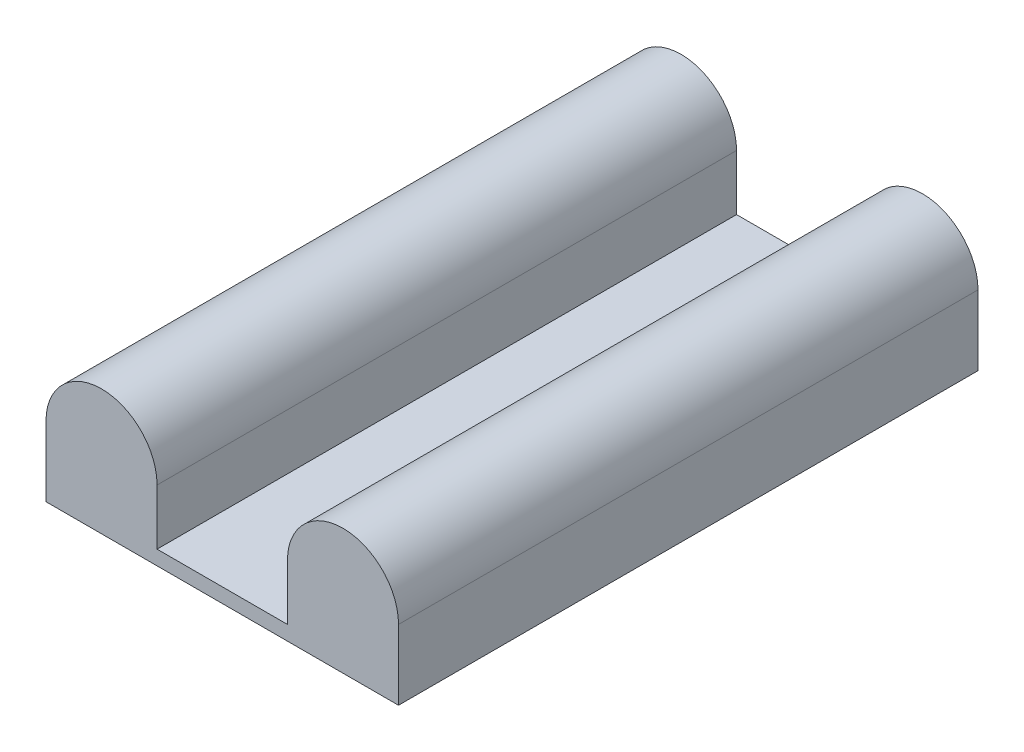
from build123d import *

# Parameters (mm, degrees)
SKETCH1_W           = 73
SKETCH1_H           = 3
BOSS_EXTRUDE1_DEPTH = 120


with BuildPart() as part:
    # Sketch1 → Boss-Extrude1 (new body)
    with BuildSketch(Plane.XY):
        with BuildLine():
            ThreePointArc((11.5, 0), (0, 11.5), (-11.5, 0))
            Line((-11.5, 0), (11.5, 0))
        make_face()
        with BuildLine():
            Line((11.5, 0), (-11.5, 0))
            ThreePointArc((-11.5, 0), (-8.131727984, -8.131727984), (0, -11.5))
            ThreePointArc((0, -11.5), (8.131727984, -8.131727984), (11.5, 0))
        make_face()
        with BuildLine():
            ThreePointArc((11.5, 0), (0, 11.5), (-11.5, 0))
            Line((-11.5, 0), (11.5, 0))
        make_face()
        with BuildLine():
            Line((11.5, 0), (-11.5, 0))
            ThreePointArc((-11.5, 0), (-8.131727984, -8.131727984), (0, -11.5))
            ThreePointArc((0, -11.5), (8.131727984, -8.131727984), (11.5, 0))
        make_face()
        with BuildLine():
            Line((11.5, -11.5), (11.5, 0))
            ThreePointArc((11.5, 0), (8.131727984, -8.131727984), (0, -11.5))
            Line((0, -11.5), (11.5, -11.5))
        make_face()
        with BuildLine():
            ThreePointArc((0, -11.5), (-8.131727984, -8.131727984), (-11.5, 0))
            Line((-11.5, 0), (-11.5, -11.5))
            Line((-11.5, -11.5), (0, -11.5))
        make_face()
        with BuildLine():
            ThreePointArc((50, -11.5), (41.868272016, -8.131727984), (38.5, 0))
            Line((38.5, 0), (38.5, -11.5))
            Line((38.5, -11.5), (50, -11.5))
        make_face()
        with BuildLine():
            ThreePointArc((61.5, 0), (50, 11.5), (38.5, 0))
            Line((38.5, 0), (61.5, 0))
        make_face()
        with BuildLine():
            Line((61.5, 0), (38.5, 0))
            ThreePointArc((38.5, 0), (41.868272016, -8.131727984), (50, -11.5))
            ThreePointArc((50, -11.5), (58.131727984, -8.131727984), (61.5, 0))
        make_face()
        with BuildLine():
            ThreePointArc((61.5, 0), (50, 11.5), (38.5, 0))
            Line((38.5, 0), (61.5, 0))
        make_face()
        with BuildLine():
            Line((61.5, 0), (38.5, 0))
            ThreePointArc((38.5, 0), (41.868272016, -8.131727984), (50, -11.5))
            ThreePointArc((50, -11.5), (58.131727984, -8.131727984), (61.5, 0))
        make_face()
        with BuildLine():
            Line((61.5, -11.5), (61.5, 0))
            ThreePointArc((61.5, 0), (58.131727984, -8.131727984), (50, -11.5))
            Line((50, -11.5), (61.5, -11.5))
        make_face()
        with Locations((25, -13)):
            Rectangle(SKETCH1_W, SKETCH1_H)
    extrude(amount=BOSS_EXTRUDE1_DEPTH)


solid = part.part
